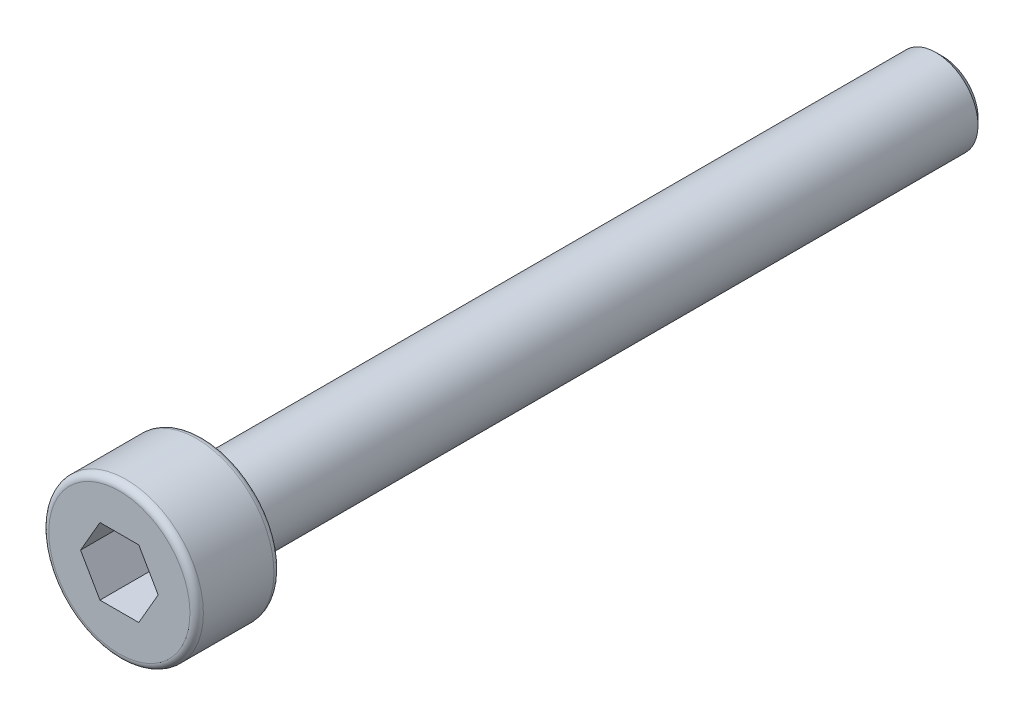
from build123d import *

# Parameters (mm, degrees)
FILLET_1_R          = 0.2
CHAMFER_1_SIZE      = 0.2
CUT_EXTRUDE_1_DEPTH = 1.5


with BuildPart() as part:
    # 草图2 → 旋转1 (revolve)
    with BuildSketch(Plane(origin=(0, 0, 0), x_dir=(0, 0, -1), z_dir=(1, 0, 0))):
        Polygon((0, 0), (0, 2.3), (2.5, 2.3), (2.5, 1.25), (24.5, 1.25), (24.5, 0), align=None)
    revolve(axis=Axis((0, 0, -24.5), (0, 0, 1)))

    # 圆角1
    fillet_1_edges = [part.edges().sort_by_distance(p)[0] for p in [
        (0, -2.3, -2.5),
        (0, -2.3, 0),
    ]]
    fillet(fillet_1_edges, radius=FILLET_1_R)

    # 倒角1
    chamfer_1_edges = [part.edges().sort_by_distance(p)[0] for p in [
        (0, -1.25, -24.5),
    ]]
    chamfer(chamfer_1_edges, length=CHAMFER_1_SIZE)

    # 草图3 → 切除-拉伸1 (cut)
    with BuildSketch(Plane.XY):
        Polygon((1.154700538, 0), (0.577350269, 1), (-0.577350269, 1), (-1.154700538, 0), (-0.577350269, -1), (0.577350269, -1), align=None)
    extrude(amount=-CUT_EXTRUDE_1_DEPTH, mode=Mode.SUBTRACT)


solid = part.part
